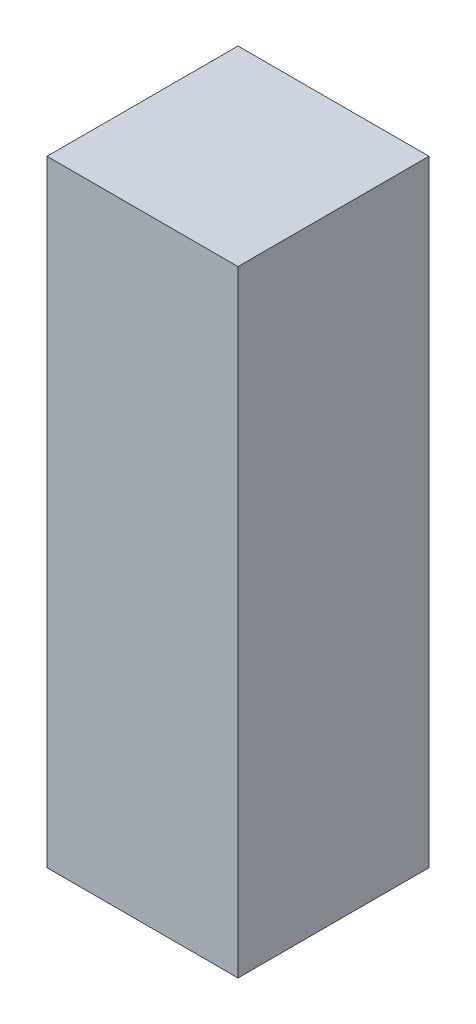
from build123d import *

# Parameters (mm, degrees)
SKETCH2_W           = 62
SKETCH2_H           = 62
BOSS_EXTRUDE1_DEPTH = 200


with BuildPart() as part:
    # Sketch2 → Boss-Extrude1 (new body)
    with BuildSketch(Plane(origin=(0, 0, 0), x_dir=(1, 0, 0), z_dir=(0, 1, 0))):
        Rectangle(SKETCH2_W, SKETCH2_H)
    extrude(amount=BOSS_EXTRUDE1_DEPTH)


solid = part.part
